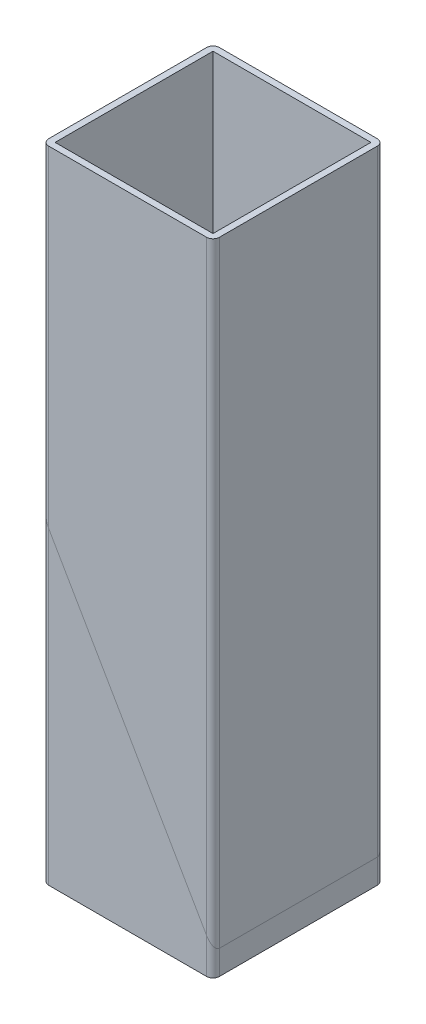
from build123d import *

# Parameters (mm, degrees)
SKETCH_1_W                     = 80
SKETCH_1_H                     = 80
SKETCH_1_W_2                   = 74
SKETCH_1_H_2                   = 74
EXTRUDE_1_DEPTH                = 300
FILLET_1_R                     = 3
SPLIT_BODIES_1_SURFACE_1_BACK  = 321.624
SPLIT_BODIES_1_SURFACE_1_DEPTH = 643.248
SPLIT_BODIES_1_SURFACE_2_BACK  = 321.624
SPLIT_BODIES_1_SURFACE_2_DEPTH = 643.248


with BuildPart() as part:
    # 草图1 → 凸台-拉伸1 (new body)
    with BuildSketch(Plane(origin=(0, 0, 0), x_dir=(1, 0, 0), z_dir=(0, 1, 0))):
        Rectangle(SKETCH_1_W, SKETCH_1_H)
        Rectangle(SKETCH_1_W_2, SKETCH_1_H_2, mode=Mode.SUBTRACT)
    extrude(amount=EXTRUDE_1_DEPTH)

    # 圆角1
    fillet_1_edges = [part.edges().sort_by_distance(p)[0] for p in [
        (40, 150, 40),
        (-40, 150, 40),
        (-40, 150, -40),
        (40, 150, -40),
    ]]
    fillet(fillet_1_edges, radius=FILLET_1_R)


with BuildPart() as body_2:
    # Split Bodies 1: the piece behind the surface
    add(part.part)
    # Split Bodies 1 surface: a surface, the sketch's curves swept straight by 643.248 mm
    with BuildLine(Plane.XY.offset(40).offset(-SPLIT_BODIES_1_SURFACE_1_BACK), mode=Mode.PRIVATE) as split_bodies_1_surface_1_path:
        Line((-40, 150), (46.414872124, 0.325050951))
    split_bodies_1_surface_1 = Shell.extrude(split_bodies_1_surface_1_path.wire(), (0 * SPLIT_BODIES_1_SURFACE_1_DEPTH, 0 * SPLIT_BODIES_1_SURFACE_1_DEPTH, 1 * SPLIT_BODIES_1_SURFACE_1_DEPTH))
    split(bisect_by=split_bodies_1_surface_1, keep=Keep.BOTTOM)


with BuildPart() as part_1:
    add(part.part)

    # Split Bodies 1: split by a surface, the side it looks to stays
    # Split Bodies 1 surface: a surface, the sketch's curves swept straight by 643.248 mm
    with BuildLine(Plane.XY.offset(40).offset(-SPLIT_BODIES_1_SURFACE_2_BACK), mode=Mode.PRIVATE) as split_bodies_1_surface_2_path:
        Line((-40, 150), (46.414872124, 0.325050951))
    split_bodies_1_surface_2 = Shell.extrude(split_bodies_1_surface_2_path.wire(), (0 * SPLIT_BODIES_1_SURFACE_2_DEPTH, 0 * SPLIT_BODIES_1_SURFACE_2_DEPTH, 1 * SPLIT_BODIES_1_SURFACE_2_DEPTH))
    split(bisect_by=split_bodies_1_surface_2, keep=Keep.TOP)


solid = Compound([body_2.part, part_1.part])
